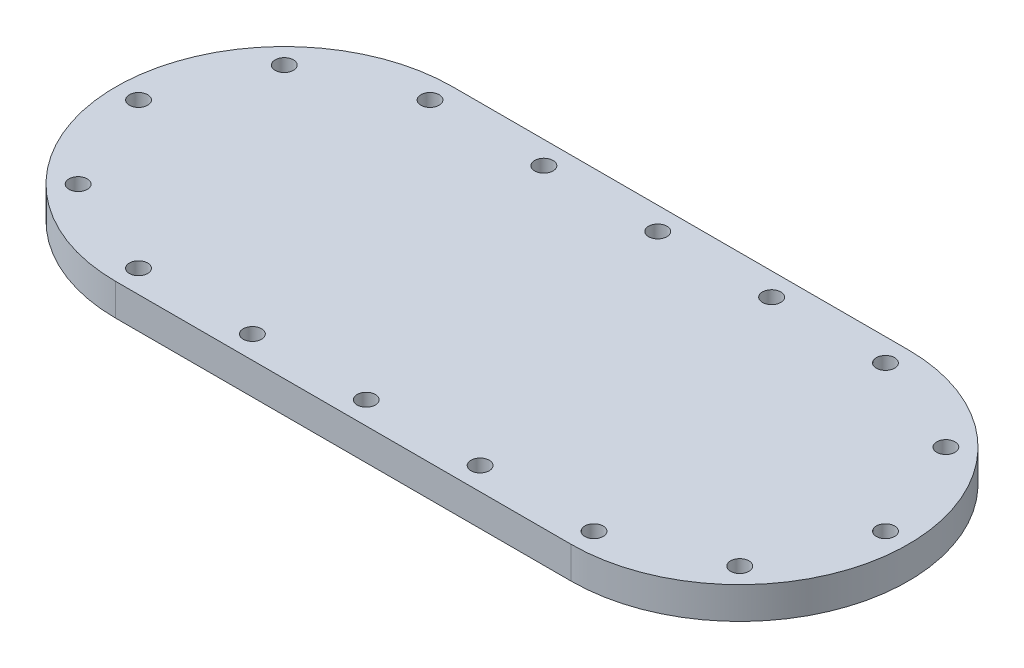
from build123d import *

# Parameters (mm, degrees)
SKETCH1_R           = 2.5527
BOSS_EXTRUDE1_DEPTH = 8.89


with BuildPart() as part:
    # Sketch1 → Boss-Extrude1 (new body)
    with BuildSketch(Plane(origin=(0, 0, 0), x_dir=(1, 0, 0), z_dir=(0, 1, 0))):
        with BuildLine():
            Line((-63.5, 46.99), (63.5, 46.99))
            ThreePointArc((63.5, 46.99), (110.49, 0), (63.5, -46.99))
            Line((63.5, -46.99), (-63.5, -46.99))
            ThreePointArc((-63.5, -46.99), (-110.49, 0), (-63.5, 46.99))
        make_face()
        with Locations(Location((-63.5, 40.64, 0), (0, 0, 270))):
            Circle(SKETCH1_R, mode=Mode.SUBTRACT)
        with Locations(Location((-31.75, 40.64, 0), (0, 0, 270))):
            Circle(SKETCH1_R, mode=Mode.SUBTRACT)
        with Locations(Location((0, 40.64, 0), (0, 0, 270))):
            Circle(SKETCH1_R, mode=Mode.SUBTRACT)
        with Locations(Location((31.75, 40.64, 0), (0, 0, 270))):
            Circle(SKETCH1_R, mode=Mode.SUBTRACT)
        with Locations(Location((63.5, 40.64, 0), (0, 0, 270))):
            Circle(SKETCH1_R, mode=Mode.SUBTRACT)
        with Locations(Location((92.236819587, 28.736819587, 0), (0, 0, 270))):
            Circle(SKETCH1_R, mode=Mode.SUBTRACT)
        with Locations(Location((104.14, 0, 0), (0, 0, 270))):
            Circle(SKETCH1_R, mode=Mode.SUBTRACT)
        with Locations(Location((92.236819587, -28.736819587, 0), (0, 0, 270))):
            Circle(SKETCH1_R, mode=Mode.SUBTRACT)
        with Locations(Location((63.5, -40.64, 0), (0, 0, 270))):
            Circle(SKETCH1_R, mode=Mode.SUBTRACT)
        with Locations(Location((-92.236819587, 28.736819587, 0), (0, 0, 270))):
            Circle(SKETCH1_R, mode=Mode.SUBTRACT)
        with Locations(Location((-104.14, 0, 0), (0, 0, 270))):
            Circle(SKETCH1_R, mode=Mode.SUBTRACT)
        with Locations(Location((-92.236819587, -28.736819587, 0), (0, 0, 270))):
            Circle(SKETCH1_R, mode=Mode.SUBTRACT)
        with Locations(Location((-63.5, -40.64, 0), (0, 0, 270))):
            Circle(SKETCH1_R, mode=Mode.SUBTRACT)
        with Locations(Location((31.75, -40.64, 0), (0, 0, 270))):
            Circle(SKETCH1_R, mode=Mode.SUBTRACT)
        with Locations(Location((0, -40.64, 0), (0, 0, 270))):
            Circle(SKETCH1_R, mode=Mode.SUBTRACT)
        with Locations(Location((-31.75, -40.64, 0), (0, 0, 270))):
            Circle(SKETCH1_R, mode=Mode.SUBTRACT)
    extrude(amount=BOSS_EXTRUDE1_DEPTH)


solid = part.part
